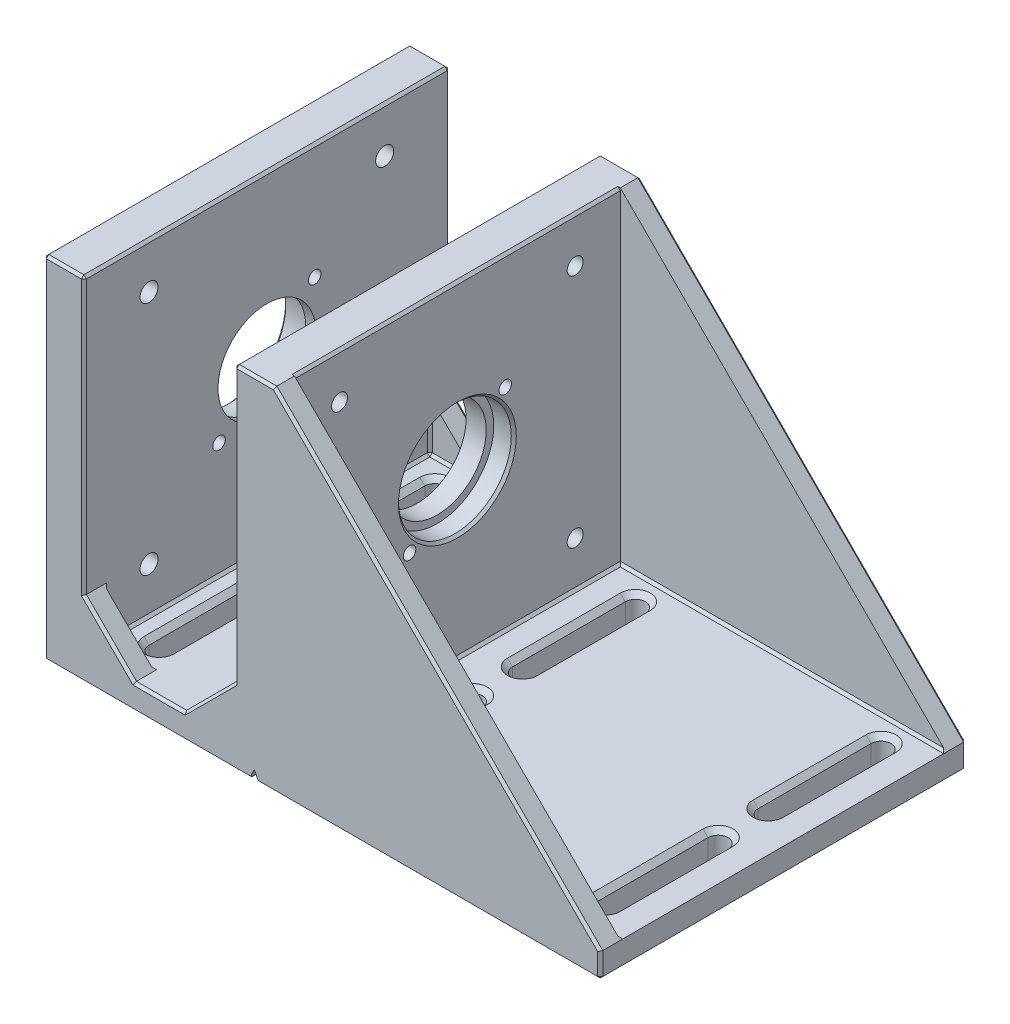
from build123d import *

# Parameters (mm, degrees)
BOSS_EXTRUDE1_DEPTH                             = 36.5
CUT_EXTRUDE1_DEPTH                              = 32.5
CUT_EXTRUDE1_DEPTH_BACK                         = 32.5
SKETCH2_W                                       = 30
SKETCH2_H                                       = 65
CUT_EXTRUDE2_DEPTH                              = 84.447588341
CUT_EXTRUDE2_DEPTH_BACK                         = 84.447588341
SKETCH3_R                                       = 11.25
SKETCH4_R                                       = 11.25
SKETCH4_R_2                                     = 9.75
BOSS_EXTRUDE2_DEPTH                             = 2
TAP_DRILL_FOR_M3X0_5_TAP1_D                     = 2.5
CSK_FOR_M3_FLAT_HEAD_MACHINE_SCREW1_D           = 3.2
CSK_FOR_M3_FLAT_HEAD_MACHINE_SCREW1_DEPTH       = 8
CSK_FOR_M3_FLAT_HEAD_MACHINE_SCREW1_CSINK_D     = 6.3
CSK_FOR_M3_FLAT_HEAD_MACHINE_SCREW1_CSINK_ANGLE = 90
CUT_EXTRUDE4_DEPTH                              = 84.447588341
CUT_EXTRUDE4_DEPTH_BACK                         = 84.447588341
CHAMFER1_SIZE                                   = 0.5
BOSS_EXTRUDE3_START                             = -34
SKETCH4_2_R                                     = 11.25
SKETCH4_2_R_2                                   = 9.75
BOSS_EXTRUDE3_DEPTH                             = 4
M3_CLEARANCE_HOLE1_D                            = 3.6
M3_CLEARANCE_HOLE1_DEPTH                        = 8
CUT_EXTRUDE3_DEPTH                              = 99.905257696
CHAMFER2_SIZE                                   = 1
CHAMFER2_OF_MIRROR1_SIZE                        = 1


with BuildPart() as part:
    # Sketch1 → Boss-Extrude1 (new, symmetric)
    with BuildSketch(Plane.XY):
        Polygon((-8, 32.5), (-8, -22.5), (-18, -32.5), (-28, -32.5), (-38, -22.5), (-38, 32.5), (-46, 32.5), (-46, -37.5), (65, -37.5), (65, -32.5), (0, 32.5), align=None)
    extrude(amount=BOSS_EXTRUDE1_DEPTH, both=True)

    # Sketch2 → Cut-Extrude1 (cut, two sides: drawn at the far end of the back side and taken through both)
    with BuildSketch(Plane.XY.offset(-CUT_EXTRUDE1_DEPTH_BACK)):
        with Locations((-23, 0)):
            Rectangle(SKETCH2_W, SKETCH2_H)
        Polygon((0, 32.5), (0, -32.5), (65, -32.5), align=None)
    extrude(amount=CUT_EXTRUDE1_DEPTH + CUT_EXTRUDE1_DEPTH_BACK, mode=Mode.SUBTRACT)

    # Sketch3 → Cut-Extrude2 (cut, two sides: drawn at the far end of the back side and taken through both)
    with BuildSketch(Plane(origin=(0, 0, 0), x_dir=(0, 0, -1), z_dir=(1, 0, 0)).offset(-CUT_EXTRUDE2_DEPTH_BACK)):
        with Locations(Location((0, 0, 0), (0, 0, 90))):
            Circle(SKETCH3_R)
    extrude(amount=CUT_EXTRUDE2_DEPTH + CUT_EXTRUDE2_DEPTH_BACK, mode=Mode.SUBTRACT)

    # Sketch4 → Boss-Extrude2 (add)
    with BuildSketch(Plane.ZY.offset(38)):
        with Locations(Location((0, 0, 0), (0, 0, 90))):
            Circle(SKETCH4_R)
        with Locations(Location((0, 0, 0), (0, 0, 270))):
            Circle(SKETCH4_R_2, mode=Mode.SUBTRACT)
    extrude(amount=BOSS_EXTRUDE2_DEPTH)

    # Tap Drill for M3x0.5 Tap1 (through all)
    with Locations(Plane.ZY.offset(46)):
        with Locations((-9.545941546, 9.545941546), (9.545941546, -9.545941546)):
            Hole(TAP_DRILL_FOR_M3X0_5_TAP1_D / 2)

    # CSK for M3 Flat Head Machine Screw1
    with Locations(Plane.ZY.offset(8)):
        with Locations((-23.5, 23.5), (23.5, 23.5), (23.5, -23.5), (-23.5, -23.5), (0, 0)):
            CounterSinkHole(CSK_FOR_M3_FLAT_HEAD_MACHINE_SCREW1_D / 2, CSK_FOR_M3_FLAT_HEAD_MACHINE_SCREW1_CSINK_D / 2, depth=CSK_FOR_M3_FLAT_HEAD_MACHINE_SCREW1_DEPTH, counter_sink_angle=CSK_FOR_M3_FLAT_HEAD_MACHINE_SCREW1_CSINK_ANGLE)

    # Sketch21 → Cut-Extrude4 (cut, two sides: drawn at the far end of the back side and taken through both)
    with BuildSketch(Plane.XY.offset(-CUT_EXTRUDE4_DEPTH_BACK)):
        Polygon((-5, -37.5), (-4, -35.5), (-3, -37.5), align=None)
    extrude(amount=CUT_EXTRUDE4_DEPTH + CUT_EXTRUDE4_DEPTH_BACK, mode=Mode.SUBTRACT)

    # Chamfer1
    chamfer1_edges = [part.edges().sort_by_distance(p)[0] for p in [
        (0, -11.25, 0),
        (-46, -11.25, 0),
        (-8, -27.5, -32.5),
        (-8, -27.5, 32.5),
        (-13, -32.5, 32.5),
        (-8, -32.5, 0),
        (-13, -32.5, -32.5),
        (-38, -27.5, 32.5),
        (-38, -27.5, -32.5),
        (-33, -32.5, -32.5),
        (-38, -32.5, 0),
        (-33, -32.5, 32.5),
        (32.5, -32.5, 32.5),
        (0, -32.5, 0),
        (32.5, -32.5, -32.5),
        (0, 32.5, 0),
        (-8, 32.5, 0),
        (-4, 32.5, 36.5),
        (-8, 5, 36.5),
        (-13, -27.5, 36.5),
        (-23, -32.5, 36.5),
        (-33, -27.5, 36.5),
        (-38, 5, 36.5),
        (-42, 32.5, 36.5),
        (-38, 32.5, 0),
        (-46, 32.5, 0),
        (-42, 32.5, -36.5),
        (-38, 5, -36.5),
        (-33, -27.5, -36.5),
        (-23, -32.5, -36.5),
        (-13, -27.5, -36.5),
        (-8, 5, -36.5),
        (-4, 32.5, -36.5),
        (32.5, 0, 36.5),
        (32.5, 0, -36.5),
        (65, -35, 36.5),
        (65, -35, -36.5),
        (-46, -2.5, -36.5),
        (-46, -2.5, 36.5),
        (65, -37.5, 0),
        (-25.5, -37.5, -36.5),
        (31, -37.5, -36.5),
        (-46, -37.5, 0),
        (31, -37.5, 36.5),
        (-25.5, -37.5, 36.5),
    ]]
    chamfer(chamfer1_edges, length=CHAMFER1_SIZE)

    # Sketch4<2> → Boss-Extrude3 (add)
    with BuildSketch(Plane.ZY.offset(38).offset(BOSS_EXTRUDE3_START)):
        with Locations(Location((0, 0, 0), (0, 0, 180))):
            Circle(SKETCH4_2_R)
        with Locations(Location((0, 0, 0), (0, 0, 270))):
            Circle(SKETCH4_2_R_2, mode=Mode.SUBTRACT)
    extrude(amount=BOSS_EXTRUDE3_DEPTH)

    # M3 Clearance Hole1
    with Locations(Plane.ZY.offset(46)):
        with Locations((-23.5, -23.5), (23.5, -23.5), (23.5, 23.5), (-23.5, 23.5)):
            Hole(M3_CLEARANCE_HOLE1_D / 2, depth=M3_CLEARANCE_HOLE1_DEPTH)

    # Sketch19 → Cut-Extrude3 (cut, through all)
    with BuildSketch(Plane(origin=(0, -32.5, 0), x_dir=(1, 0, 0), z_dir=(0, 1, 0))):
        with BuildLine():
            Line((-34, 5), (-34, 27.5))
            ThreePointArc((-34, 27.5), (-32, 29.5), (-30, 27.5))
            Line((-30, 27.5), (-30, 5))
            ThreePointArc((-30, 5), (-32, 3), (-34, 5))
        make_face()
        with BuildLine():
            Line((-16, 5), (-16, 27.5))
            ThreePointArc((-16, 27.5), (-14, 29.5), (-12, 27.5))
            Line((-12, 27.5), (-12, 5))
            ThreePointArc((-12, 5), (-14, 3), (-16, 5))
        make_face()
        with BuildLine():
            Line((6, 5), (6, 27.5))
            ThreePointArc((6, 27.5), (8, 29.5), (10, 27.5))
            Line((10, 27.5), (10, 5))
            ThreePointArc((10, 5), (8, 3), (6, 5))
        make_face()
        with BuildLine():
            Line((55, 5), (55, 27.5))
            ThreePointArc((55, 27.5), (57, 29.5), (59, 27.5))
            Line((59, 27.5), (59, 5))
            ThreePointArc((59, 5), (57, 3), (55, 5))
        make_face()
    cut_extrude3 = extrude(amount=-CUT_EXTRUDE3_DEPTH, mode=Mode.SUBTRACT)

    # Chamfer2
    chamfer2_edges = [part.edges().sort_by_distance(p)[0] for p in [
        (-32, -32.5, -3),
        (-30, -32.5, -16.25),
        (-32, -32.5, -29.5),
        (-34, -32.5, -16.25),
        (-14, -32.5, -3),
        (-12, -32.5, -16.25),
        (-14, -32.5, -29.5),
        (-16, -32.5, -16.25),
        (8, -32.5, -3),
        (10, -32.5, -16.25),
        (8, -32.5, -29.5),
        (6, -32.5, -16.25),
        (57, -32.5, -3),
        (59, -32.5, -16.25),
        (57, -32.5, -29.5),
        (55, -32.5, -16.25),
    ]]
    chamfer(chamfer2_edges, length=CHAMFER2_SIZE)

    # Mirror1: Cut-Extrude3 across plane
    add(cut_extrude3.mirror(Plane.XY), mode=Mode.SUBTRACT)

    # Chamfer2 of Mirror1
    chamfer2_of_mirror1_edges = [part.edges().sort_by_distance(p)[0] for p in [
        (-32, -32.5, 3),
        (-30, -32.5, 16.25),
        (-32, -32.5, 29.5),
        (-34, -32.5, 16.25),
        (-14, -32.5, 3),
        (-12, -32.5, 16.25),
        (-14, -32.5, 29.5),
        (-16, -32.5, 16.25),
        (8, -32.5, 3),
        (10, -32.5, 16.25),
        (8, -32.5, 29.5),
        (6, -32.5, 16.25),
        (57, -32.5, 3),
        (59, -32.5, 16.25),
        (57, -32.5, 29.5),
        (55, -32.5, 16.25),
    ]]
    chamfer(chamfer2_of_mirror1_edges, length=CHAMFER2_OF_MIRROR1_SIZE)


solid = part.part
